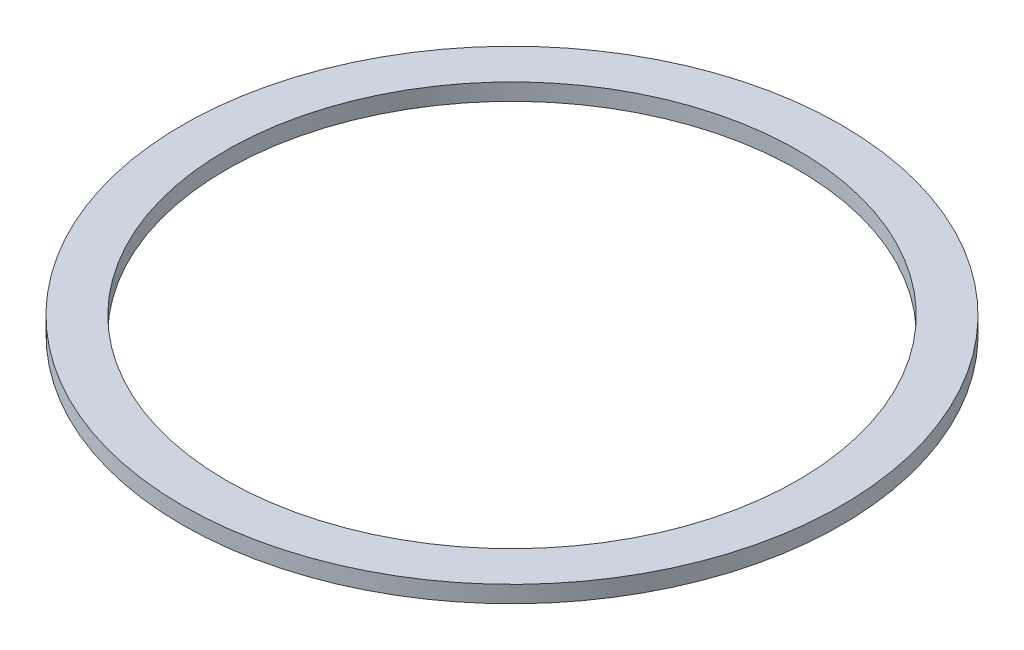
from build123d import *

# Parameters (mm, degrees)
SKETCH_1_R      = 196
SKETCH_1_R_2    = 170
EXTRUDE_1_DEPTH = 10


with BuildPart() as part:
    # 草图1 → 凸台-拉伸1 (new body)
    with BuildSketch(Plane(origin=(0, 0, 0), x_dir=(1, 0, 0), z_dir=(0, 1, 0))):
        with Locations(Location((0, 0, 0), (0, 0, 270))):
            Circle(SKETCH_1_R)
        with Locations(Location((0, 0, 0), (0, 0, 270))):
            Circle(SKETCH_1_R_2, mode=Mode.SUBTRACT)
    extrude(amount=EXTRUDE_1_DEPTH)


solid = part.part
